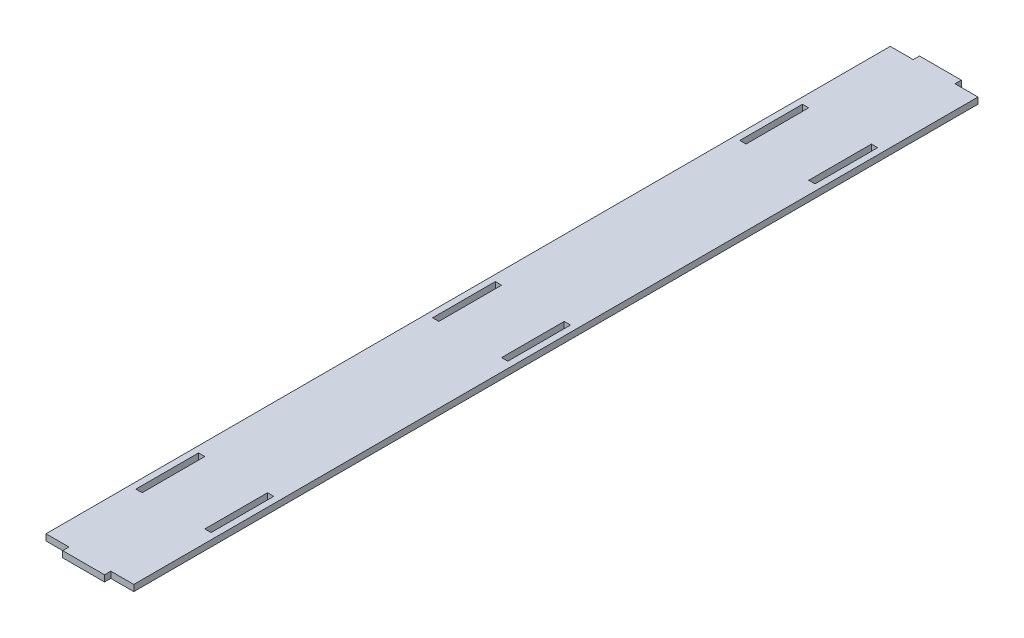
from build123d import *

# Parameters (mm, degrees)
SKETCH1_W           = 3
SKETCH1_H           = 30
BOSS_EXTRUDE1_DEPTH = 3


with BuildPart() as part:
    # Sketch1 → Boss-Extrude1 (new body)
    with BuildSketch(Plane(origin=(0, 0, 0), x_dir=(1, 0, 0), z_dir=(0, 1, 0))):
        Polygon((31, 0), (42, 0), (42, 404), (31, 404), (31, 407), (11, 407), (11, 404), (0, 404), (0, 0), (11, 0), (11, -3), (31, -3), align=None)
        with Locations((37.5, 344)):
            Rectangle(SKETCH1_W, SKETCH1_H, mode=Mode.SUBTRACT)
        with Locations((37.5, 197)):
            Rectangle(SKETCH1_W, SKETCH1_H, mode=Mode.SUBTRACT)
        with Locations((37.5, 55)):
            Rectangle(SKETCH1_W, SKETCH1_H, mode=Mode.SUBTRACT)
        with Locations((4.5, 55)):
            Rectangle(SKETCH1_W, SKETCH1_H, mode=Mode.SUBTRACT)
        with Locations((4.5, 197)):
            Rectangle(SKETCH1_W, SKETCH1_H, mode=Mode.SUBTRACT)
        with Locations((4.5, 344)):
            Rectangle(SKETCH1_W, SKETCH1_H, mode=Mode.SUBTRACT)
    extrude(amount=BOSS_EXTRUDE1_DEPTH)


solid = part.part
